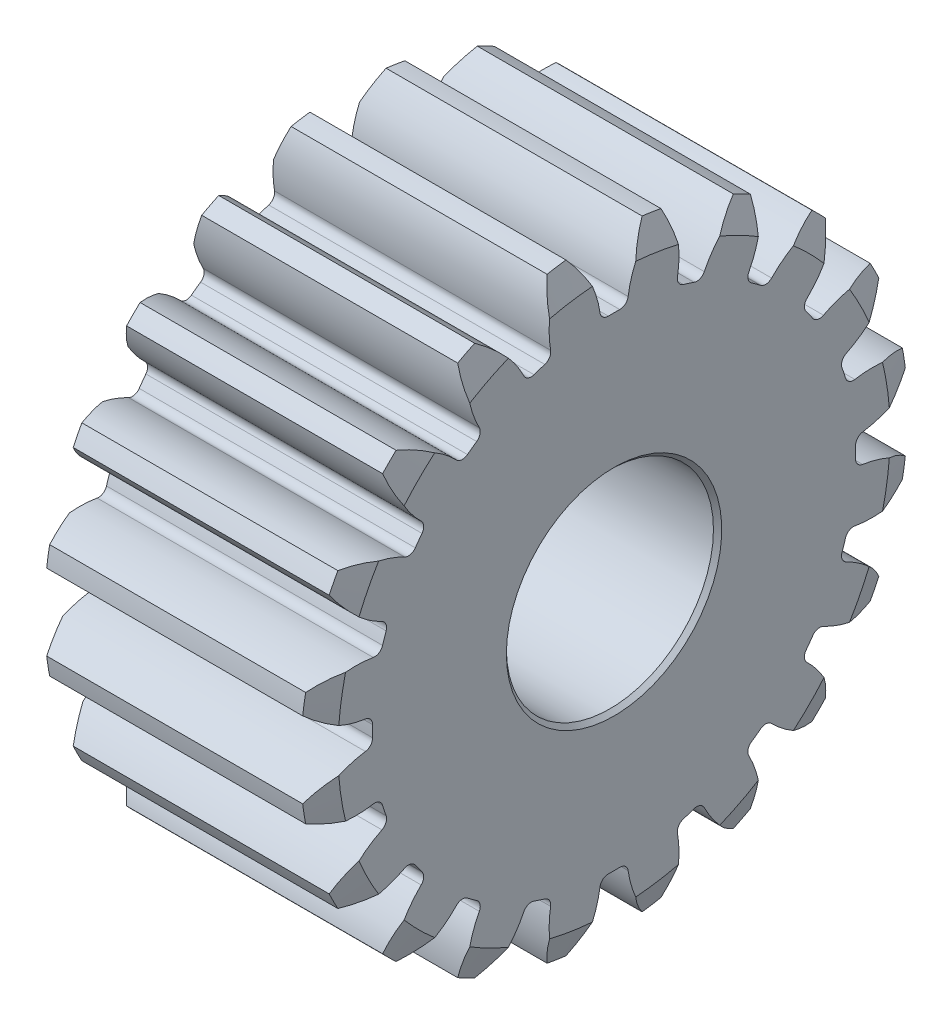
from build123d import *

# Parameters (mm, degrees)
SKETCH_1_W                       = 20
SKETCH_1_H                       = 22
CUT_EXTRUDE_15_DEPTH             = 37.986484018
FILLET_1_R                       = 0.6
PATTERN_CIRCULAR_1_COUNT         = 20
FILLET_1_OF_PATTERN_CIRCULAR_1_R = 0.6
SKETCH_5_R                       = 7.5
CUT_EXTRUDE_3_DEPTH              = 37.780351585
CHAMFER_1_SIZE                   = 0.3


with BuildPart() as part:
    # 草图1 → 旋转1 (revolve)
    with BuildSketch(Plane.XY, mode=Mode.PRIVATE) as revolve_1_sk:
        with Locations((10, 11)):
            Rectangle(SKETCH_1_W, SKETCH_1_H)
    revolve(revolve_1_sk.sketch.rotate(Axis((0, 0, 0), (1, 0, 0)), 90), axis=Axis((0, 0, 0), (1, 0, 0)))

    # 草图21 → 切除-拉伸15 (cut, through all)
    with BuildSketch(Plane.ZY):
        with BuildLine():
            ThreePointArc((17.473559205, -0.961628148), (17.5, 0), (17.473559205, 0.961628148))
            ThreePointArc((17.473559205, 0.961628148), (19.794926609, 1.508263158), (21.826523429, 2.757331138))
            ThreePointArc((21.826523429, 2.757331138), (22, 0), (21.826523429, -2.757331138))
            ThreePointArc((21.826523429, -2.757331138), (19.794926609, -1.508263158), (17.473559205, -0.961628148))
        make_face()
    cut_extrude_15 = extrude(amount=-CUT_EXTRUDE_15_DEPTH, mode=Mode.SUBTRACT)

    # 圆角1
    fillet_1_edges = [part.edges().sort_by_distance(p)[0] for p in [
        (10, 0.961628148, 17.473559205),
        (10, -0.961628148, 17.473559205),
    ]]
    fillet(fillet_1_edges, radius=FILLET_1_R)

    # 阵列(圆周)1: 切除-拉伸15 ×20 about axis
    pattern_circular_1_axis = Axis((0, 0, 0), (1, 0, 0))
    for i in range(1, PATTERN_CIRCULAR_1_COUNT):
        add(cut_extrude_15.rotate(pattern_circular_1_axis, i * 360 / PATTERN_CIRCULAR_1_COUNT), mode=Mode.SUBTRACT)

    # 圆角1 of 阵列(圆周)1
    fillet_1_of_pattern_circular_1_edges = [part.edges().sort_by_distance(p)[0] for p in [
        (10, -4.48506403, 16.915501785),
        (10, -6.314189464, 16.321182905),
        (10, -9.492726892, 14.701637193),
        (10, -11.04867392, 13.571175506),
        (10, -13.571175506, 11.04867392),
        (10, -14.701637193, 9.492726892),
        (10, -16.321182905, 6.314189464),
        (10, -16.915501785, 4.48506403),
        (10, -17.473559205, 0.961628148),
        (10, -17.473559205, -0.961628148),
        (10, -16.915501785, -4.48506403),
        (10, -16.321182905, -6.314189464),
        (10, -14.701637193, -9.492726892),
        (10, -13.571175506, -11.04867392),
        (10, -11.04867392, -13.571175506),
        (10, -9.492726892, -14.701637193),
        (10, -6.314189464, -16.321182905),
        (10, -4.48506403, -16.915501785),
        (10, -0.961628148, -17.473559205),
        (10, 0.961628148, -17.473559205),
        (10, 4.48506403, -16.915501785),
        (10, 6.314189464, -16.321182905),
        (10, 9.492726892, -14.701637193),
        (10, 11.04867392, -13.571175506),
        (10, 13.571175506, -11.04867392),
        (10, 14.701637193, -9.492726892),
        (10, 16.321182905, -6.314189464),
        (10, 16.915501785, -4.48506403),
        (10, 17.473559205, -0.961628148),
        (10, 17.473559205, 0.961628148),
        (10, 16.915501785, 4.48506403),
        (10, 16.321182905, 6.314189464),
        (10, 14.701637193, 9.492726892),
        (10, 13.571175506, 11.04867392),
        (10, 11.04867392, 13.571175506),
        (10, 9.492726892, 14.701637193),
        (10, 6.314189464, 16.321182905),
        (10, 4.48506403, 16.915501785),
    ]]
    fillet(fillet_1_of_pattern_circular_1_edges, radius=FILLET_1_OF_PATTERN_CIRCULAR_1_R)

    # 草图5 → 切除-拉伸3 (cut, through all)
    with BuildSketch(Plane.ZY):
        Circle(SKETCH_5_R)
    extrude(amount=-CUT_EXTRUDE_3_DEPTH, mode=Mode.SUBTRACT)

    # 倒角1
    chamfer_1_edges = [part.edges().sort_by_distance(p)[0] for p in [
        (20, 0, -7.5),
        (0, 0, -7.5),
    ]]
    chamfer(chamfer_1_edges, length=CHAMFER_1_SIZE)

    # 草图20 → 切除-旋转1 (revolve, cut)
    with BuildSketch(Plane.XY, mode=Mode.PRIVATE) as cut_revolve_1_sk:
        Polygon((0, 20), (0, 22), (0.727940469, 22), align=None)
        Polygon((19.272059531, 22), (20, 20), (20, 22), align=None)
    revolve(cut_revolve_1_sk.sketch.rotate(Axis((-1000, 0, 0), (1, 0, 0)), 270), axis=Axis((-1000, 0, 0), (1, 0, 0)), mode=Mode.SUBTRACT)


solid = part.part
